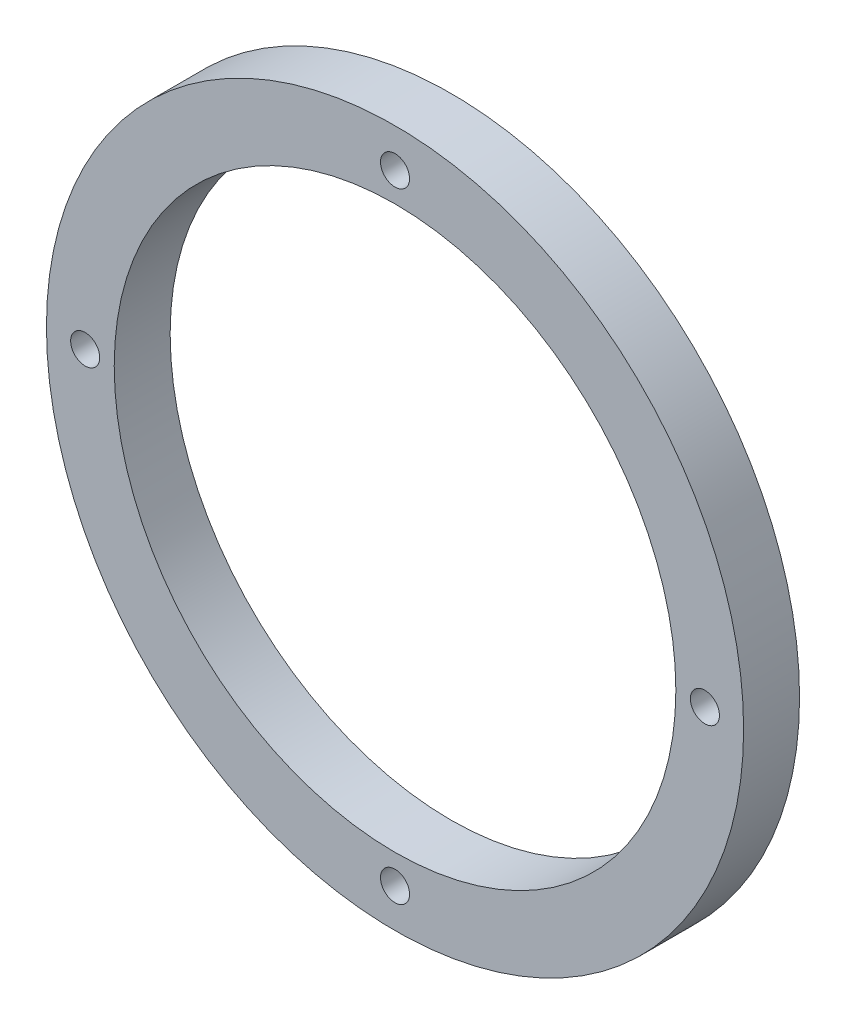
from build123d import *

# Parameters (mm, degrees)
SKETCH1_R           = 57.15
SKETCH1_R_2         = 46.0375
SKETCH1_R_3         = 2.38125
BOSS_EXTRUDE1_DEPTH = 9.1694


with BuildPart() as part:
    # Sketch1 → Boss-Extrude1 (new body)
    with BuildSketch(Plane.XY):
        Circle(SKETCH1_R)
        Circle(SKETCH1_R_2, mode=Mode.SUBTRACT)
        with Locations((0, 50.8)):
            Circle(SKETCH1_R_3, mode=Mode.SUBTRACT)
        with Locations((50.8, 0)):
            Circle(SKETCH1_R_3, mode=Mode.SUBTRACT)
        with Locations((0, -50.8)):
            Circle(SKETCH1_R_3, mode=Mode.SUBTRACT)
        with Locations((-50.8, 0)):
            Circle(SKETCH1_R_3, mode=Mode.SUBTRACT)
    extrude(amount=BOSS_EXTRUDE1_DEPTH)


solid = part.part
